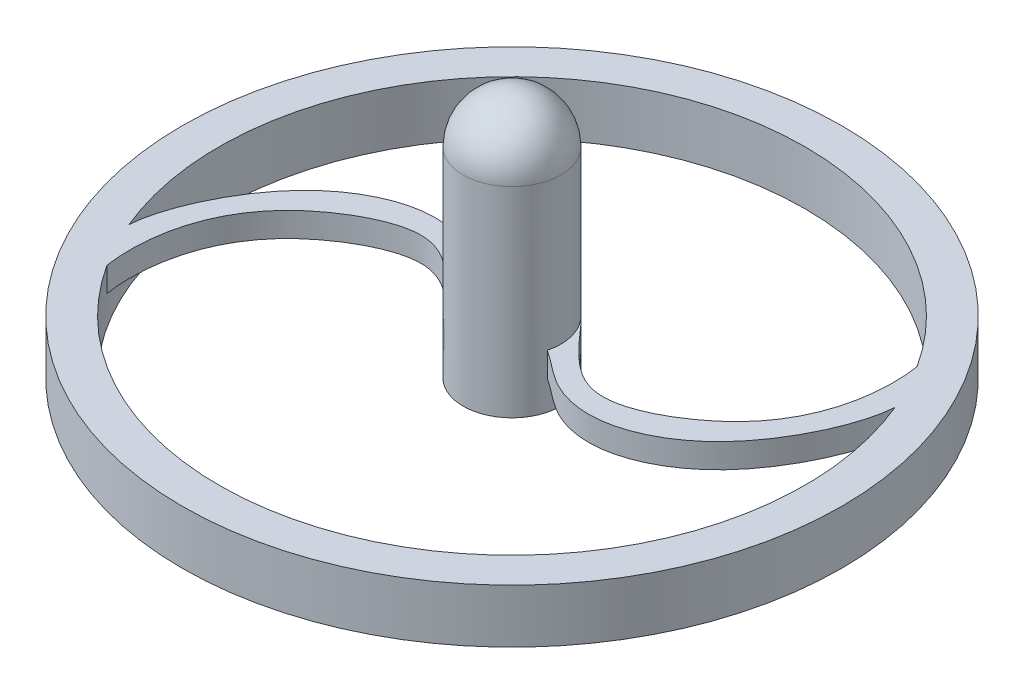
from build123d import *
from build123d.topology import SkipClean

# Parameters (mm, degrees)
SALIENTE_EXTRUIR1_DEPTH = 1
MATRIZC1_COUNT          = 2
CROQUIS2_R              = 2
SALIENTE_EXTRUIR2_DEPTH = 8
REDONDEO1_R             = 2
SALIENTE_EXTRUIR3_START = 1.2
CROQUIS3_R              = 13.5
CROQUIS3_R_2            = 12
SALIENTE_EXTRUIR3_DEPTH = 1.2
SALIENTE_EXTRUIR4_START = 1.2
CROQUIS4_R              = 2
SALIENTE_EXTRUIR4_DEPTH = 1.2


with BuildPart() as part:
    # Croquis1 → Saliente-Extruir1 (new body)
    with BuildSketch(Plane(origin=(0, 0, 0), x_dir=(1, 0, 0), z_dir=(0, 1, 0))):
        with BuildLine():
            Line((0, 13.5), (0, 12))
            ThreePointArc((0, 12), (-9.980726138, 6.662214779), (-11.082290197, -4.602482373))
            add(Edge.make_bspline(
                [(-11.082290197, -4.602482373), (-11.00840419, -3.348074009), (-9.319606871, 0.45967832), (-5.885100929, 2.140100591), (-3.256465409, 1.683534759), (-2.521994609, 0.852903354), (-1.938361352, 0.49270201)],
                knots=[0, 0, 0, 0, 0.307401752, 0.611772427, 0.741286119, 1, 1, 1, 1], degree=3))
            ThreePointArc((-1.938361352, 0.49270201), (-1.227720648, 1.578829316), (0, 2))
            Line((0, 2), (0, -2))
            ThreePointArc((0, -2), (-0.610407114, -1.904574271), (-1.162565685, -1.627403155))
            add(Edge.make_bspline(
                [(-10.085301, -6.502822752), (-10.082838156, -6.506642403), (-10.985626663, -2.087609579), (-5.366270818, 1.292290157), (-2.947582336, 0.671775941), (-1.66061048, -1.320024502), (-1.162565685, -1.627403155)],
                knots=[0, 0, 0, 0, 0.481214874, 0.664290716, 0.77922591, 1, 1, 1, 1], degree=3))
            ThreePointArc((-10.085301, -6.502822752), (-5.743088323, -10.536457493), (0, -12))
            Line((0, -12), (0, -13.5))
            ThreePointArc((0, -13.5), (-13.5, 0), (0, 13.5))
        make_face()
    saliente_extruir1 = extrude(amount=SALIENTE_EXTRUIR1_DEPTH)

    # MatrizC1: Saliente-Extruir1 ×2 about axis
    matrizc1_axis = Axis((0, 1.05, 0), (0, -1, 0))
    for i in range(1, MATRIZC1_COUNT):
        add(saliente_extruir1.rotate(matrizc1_axis, i * 360 / MATRIZC1_COUNT))

    # Croquis2 → Saliente-Extruir2 (add)
    with BuildSketch(Plane(origin=(0, 1, 0), x_dir=(1, 0, 0), z_dir=(0, 1, 0))):
        Circle(CROQUIS2_R)
    extrude(amount=SALIENTE_EXTRUIR2_DEPTH)

    # Redondeo1
    redondeo1_edges = [part.edges().sort_by_distance(p)[0] for p in [
        (-2, 9, 0),
    ]]
    fillet(redondeo1_edges, radius=REDONDEO1_R)

    # Croquis3 → Saliente-Extruir3 (add)
    with SkipClean():  # the faces are left unmerged after this step: merging them gives an invalid solid
        with BuildSketch(Plane.XZ.offset(SALIENTE_EXTRUIR3_START)):
            Circle(CROQUIS3_R)
            Circle(CROQUIS3_R_2, mode=Mode.SUBTRACT)
        extrude(amount=-SALIENTE_EXTRUIR3_DEPTH)

    # Croquis4 → Saliente-Extruir4 (add)
    with SkipClean():  # the faces are left unmerged after this step: merging them gives an invalid solid
        with BuildSketch(Plane.XZ.offset(SALIENTE_EXTRUIR4_START)):
            Circle(CROQUIS4_R)
        extrude(amount=-SALIENTE_EXTRUIR4_DEPTH)


solid = part.part
